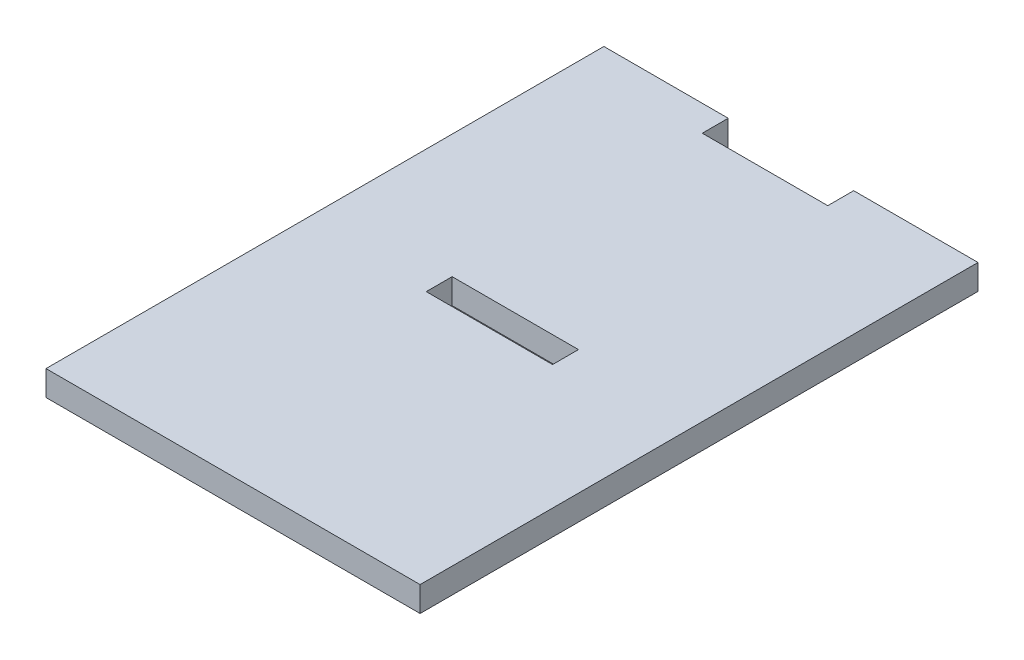
from build123d import *

# Parameters (mm, degrees)
SKETCH2_W           = 15.1
SKETCH2_H           = 3.1
BOSS_EXTRUDE3_DEPTH = 3


with BuildPart() as part:
    # Sketch2 → Boss-Extrude3 (new body)
    with BuildSketch(Plane(origin=(0, 0, 0), x_dir=(1, 0, 0), z_dir=(0, 1, 0))):
        Polygon((0, 0), (44.72, 0), (44.72, 66.69), (29.86, 66.69), (29.86, 63.59), (14.86, 63.59), (14.86, 66.69), (0, 66.69), align=None)
        with Locations((22.31, 32.24)):
            Rectangle(SKETCH2_W, SKETCH2_H, mode=Mode.SUBTRACT)
    extrude(amount=BOSS_EXTRUDE3_DEPTH)


solid = part.part
